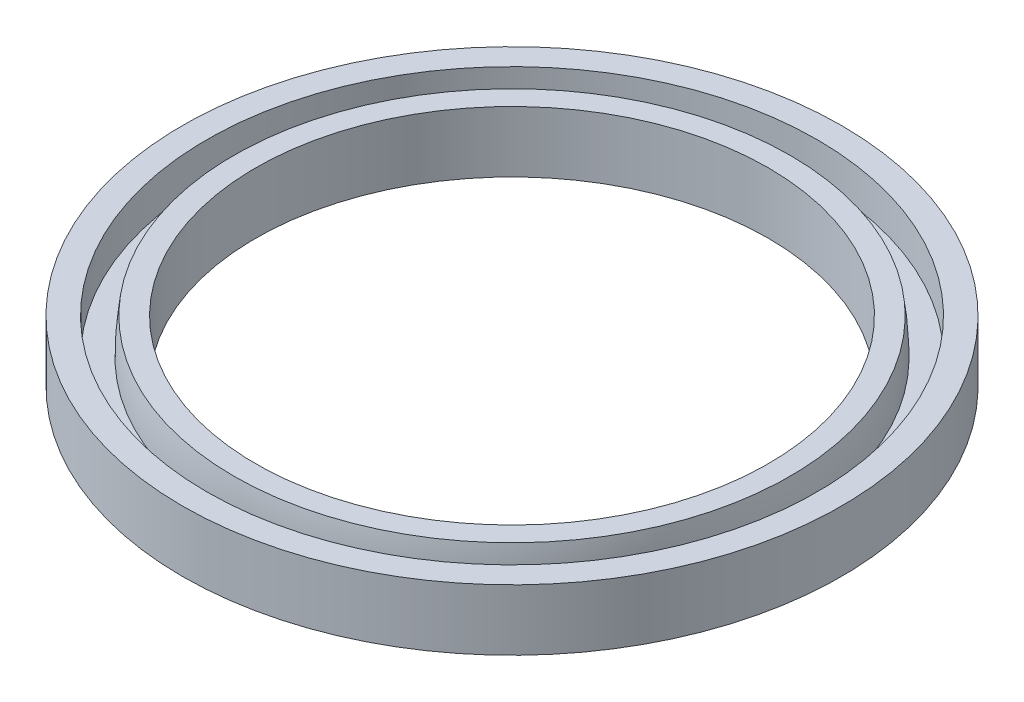
from build123d import *


with BuildPart() as part:
    # Sketch1 → Revolve1 (revolve)
    with BuildSketch(Plane(origin=(0, 0, 0), x_dir=(0, 0, -1), z_dir=(1, 0, 0))):
        with BuildLine():
            Line((25, 3), (27, 3))
            Line((27, 3), (27, -2))
            Line((27, -2), (21, -2))
            Line((21, -2), (21, 3))
            Line((21, 3), (22.778508502, 3))
            ThreePointArc((22.778508502, 3), (22.944551872, 1.504082651), (23, 0))
            Line((23, 0), (25, 0))
            Line((25, 0), (25, 3))
        make_face()
    revolve(axis=Axis((0, -564.58955378, 0), (0, 1, 0)))


solid = part.part
